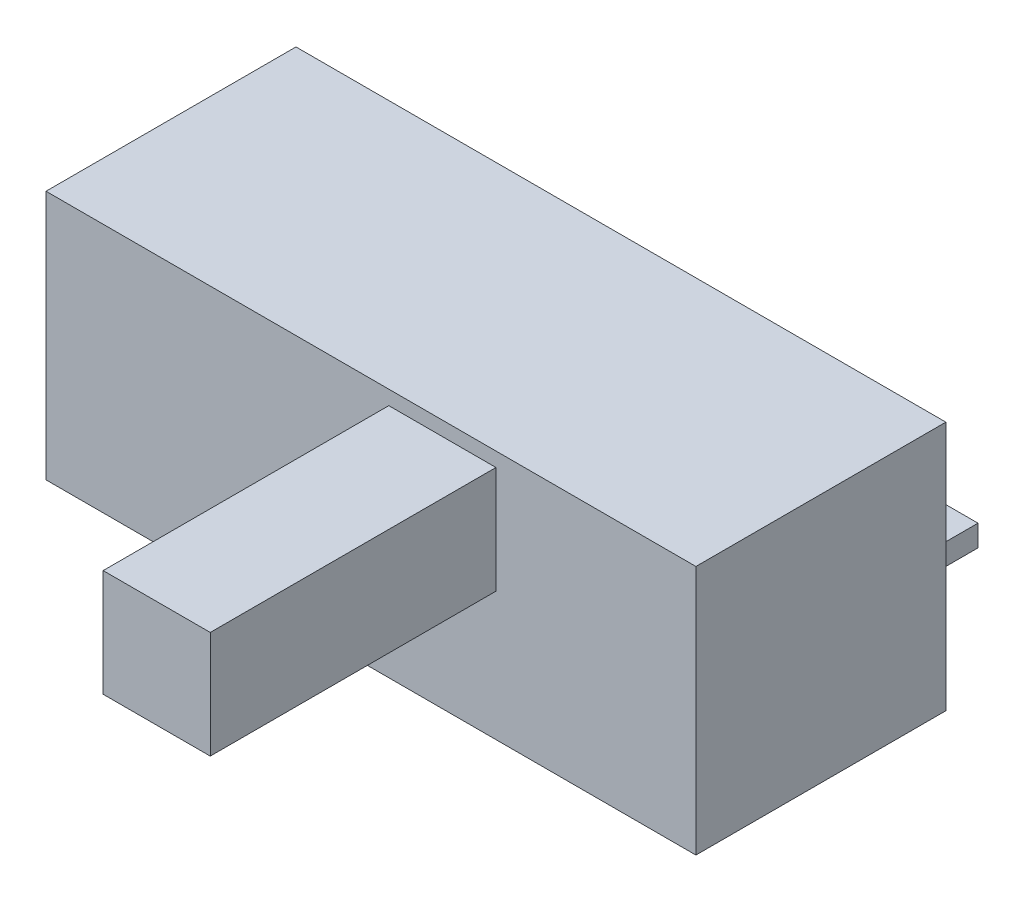
from build123d import *

# Parameters (mm, degrees)
SKETCH_1_W                 = 9.1
SKETCH_1_H                 = 3.5
EXTRUDE_1_DEPTH            = 3.5
SKETCH_2_W                 = 1.5
SKETCH_2_H                 = 1.5
EXTRUDE_2_DEPTH            = 4
SKETCH_3_R                 = 0.35
EXTRUDE_3_DEPTH            = 0.5
SKETCH_5_W                 = 0.6
SKETCH_5_H                 = 0.3
PATTERN_LINEAR_1_COUNT     = 2
PATTERN_LINEAR_1_PITCH     = 2.5
PATTERN_LINEAR_1_COL_COUNT = 2
PATTERN_LINEAR_1_COL_PITCH = 2.5


with BuildPart() as part:
    # 草图1 → 凸台-拉伸1 (new body)
    with BuildSketch(Plane.XY):
        with Locations((4.55, 1.75)):
            Rectangle(SKETCH_1_W, SKETCH_1_H)
    extrude(amount=EXTRUDE_1_DEPTH)

    # 草图2 → 凸台-拉伸2 (add)
    with BuildSketch(Plane.XY.offset(3.5)):
        with Locations((5.55, 2.55)):
            Rectangle(SKETCH_2_W, SKETCH_2_H)
    extrude(amount=EXTRUDE_2_DEPTH)

    # 草图3 → 凸台-拉伸3 (add)
    with BuildSketch(Plane.XZ):
        with Locations(Location((1.15, 1.75, 0), (0, 0, 90))):
            Circle(SKETCH_3_R)
        with Locations(Location((7.95, 1.75, 0), (0, 0, 90))):
            Circle(SKETCH_3_R)
    extrude(amount=EXTRUDE_3_DEPTH)

    # 扫描1: sweep along a path in 草图4
    with BuildLine(Plane.ZY.offset(-4.55)) as sweep_1_path:
        Line((-2.2, 0.15), (-1.060798769, 0.15))
        Line((-1.060798769, 0.15), (-0.708229264, 0.608340356))
        Line((-0.708229264, 0.608340356), (0, 0.608340356))
    # 草图5 → 扫描1 (sweep)
    with BuildSketch(Plane(origin=(0, 0, -2.2), x_dir=(-1, 0, 0), z_dir=(0, 0, -1))):
        with Locations((-4.55, 0.15)):
            Rectangle(SKETCH_5_W, SKETCH_5_H)
    sweep_1 = sweep(path=sweep_1_path.line, transition=Transition.RIGHT)

    # 阵列(线性)1: 扫描1 ×2
    with Locations(*[(i * PATTERN_LINEAR_1_PITCH, 0, 0) for i in range(1, PATTERN_LINEAR_1_COUNT)]):
        add(sweep_1)

    # 阵列(线性)1 col: 扫描1 ×2
    with Locations(*[(-i * PATTERN_LINEAR_1_COL_PITCH, 0, 0) for i in range(1, PATTERN_LINEAR_1_COL_COUNT)]):
        add(sweep_1)


solid = part.part
